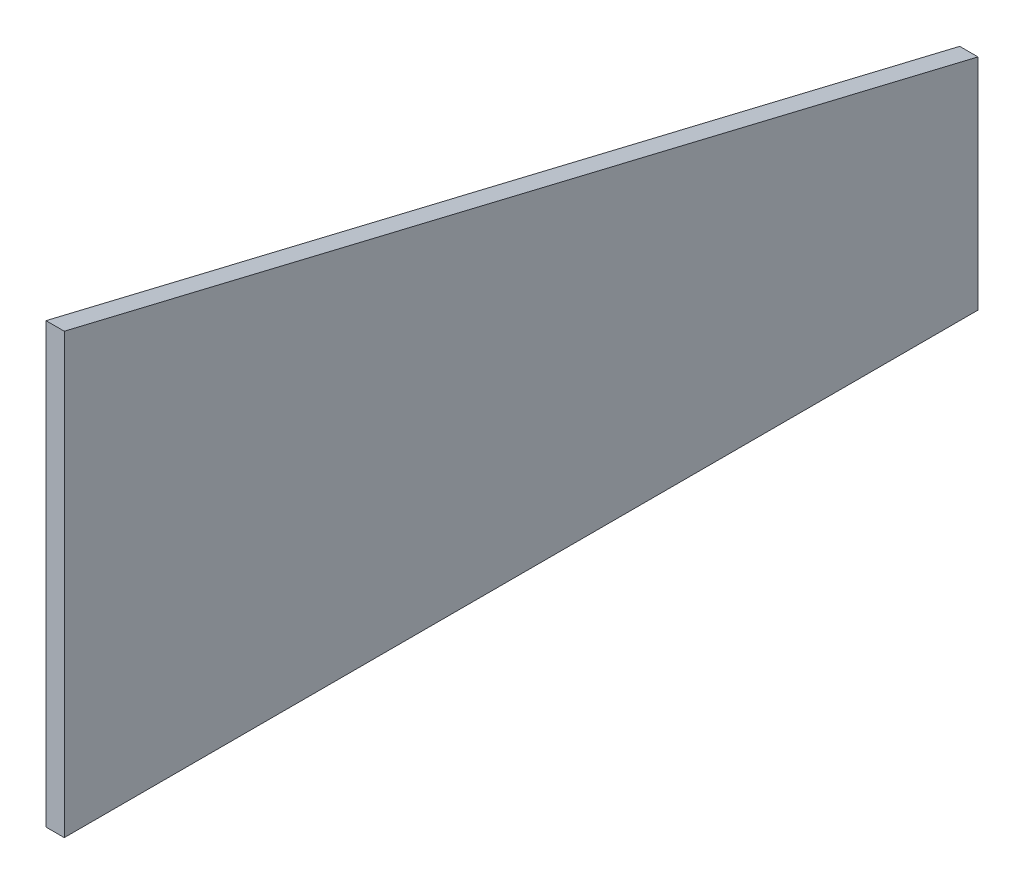
from build123d import *

# Parameters (mm, degrees)
BOSS_EXTRUDE1_DEPTH = 6.35


with BuildPart() as part:
    # Sketch1 → Boss-Extrude1 (new body)
    with BuildSketch(Plane(origin=(0, 0, 0), x_dir=(0, 0, -1), z_dir=(1, 0, 0))):
        Polygon((0, 0), (317.5, 0), (317.5, 76.2), (0, 152.4), align=None)
    extrude(amount=BOSS_EXTRUDE1_DEPTH)


solid = part.part
